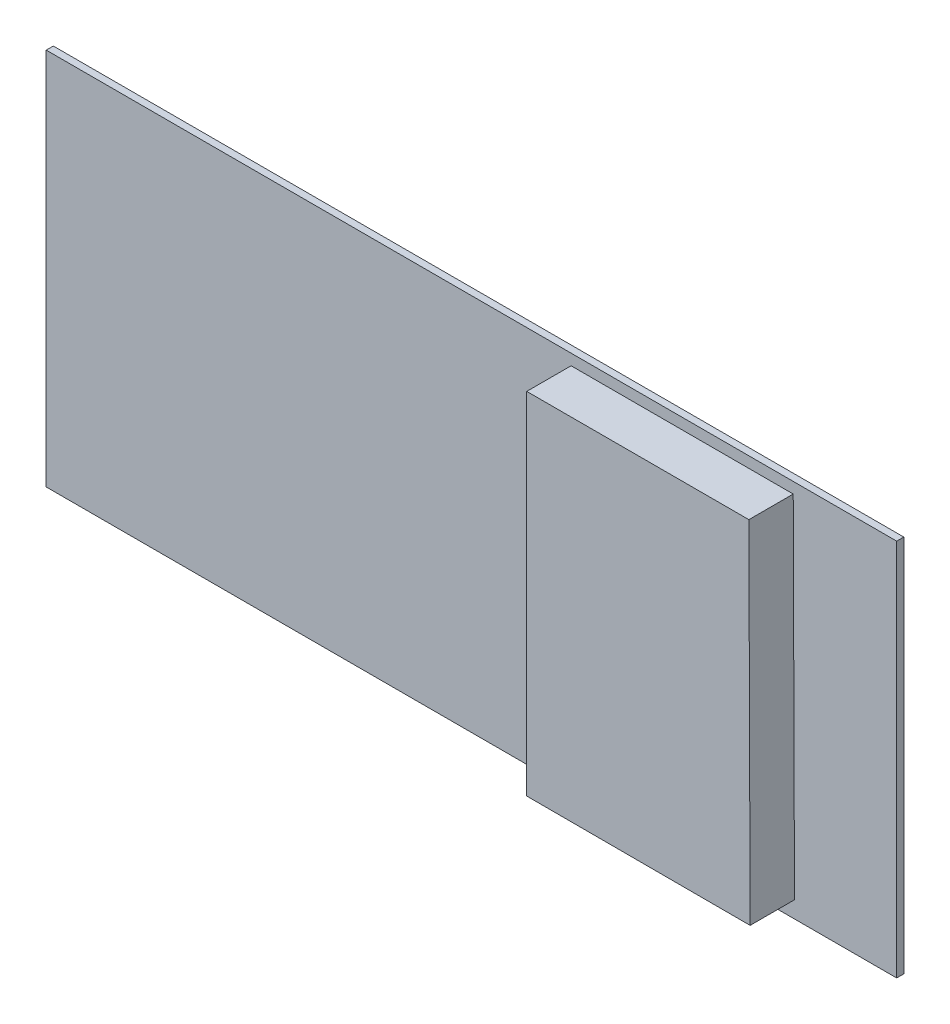
from build123d import *

# Parameters (mm, degrees)
SKETCH1_W           = 134.1999983
SKETCH1_H           = 59.69999998
BOSS_EXTRUDE1_DEPTH = 1.12
BOSS_EXTRUDE2_DEPTH = 7


with BuildPart() as part:
    # Sketch1 → Boss-Extrude1 (new body)
    with BuildSketch(Plane.XY):
        with Locations((145.59999963, 116.24999991)):
            Rectangle(SKETCH1_W, SKETCH1_H)
    extrude(amount=BOSS_EXTRUDE1_DEPTH)

    # Sketch2 → Boss-Extrude2 (add)
    with BuildSketch(Plane.XY.offset(1.12)):
        Polygon((161.3255092, 89.07300956), (196.57449128, 89.02550902), (196.37449168, 144.37449154), (161.3255092, 144.37449154), align=None)
    extrude(amount=BOSS_EXTRUDE2_DEPTH)


solid = part.part
